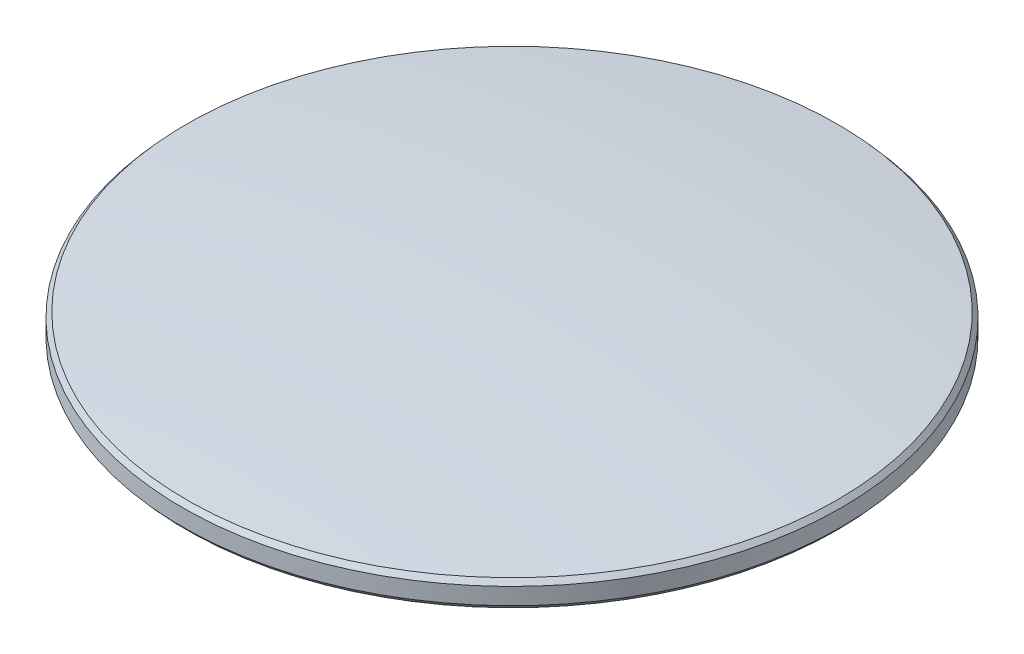
from build123d import *

# Parameters (mm, degrees)
CHANFREIN1_SIZE              = 0.5
CHANFREIN1_OF_SYM_TRIE1_SIZE = 0.5


with BuildPart() as part:
    # Esquisse1 → Révolution1 (revolve)
    with BuildSketch(Plane.XY, mode=Mode.PRIVATE) as r_volution1_sk:
        with BuildLine():
            Line((0, 0), (0, 4))
            ThreePointArc((0, 4), (-19.789517427, 3.374375349), (-39.5, 1.5))
            Line((-39.5, 1.5), (-39.5, 0))
            Line((-39.5, 0), (0, 0))
        make_face()
    r_volution1 = revolve(r_volution1_sk.sketch.rotate(Axis((0, 0, 0), (0, 1, 0)), 180), axis=Axis((0, 0, 0), (0, 1, 0)))

    # Chanfrein1
    chanfrein1_edges = [part.edges().sort_by_distance(p)[0] for p in [
        (-39.5, 1.5, 0),
    ]]
    chamfer(chanfrein1_edges, length=CHANFREIN1_SIZE)

    # Symétrie1: Révolution1 across plane
    add(r_volution1.mirror(Plane(origin=(-39.5, 0, 0), x_dir=(0, 0, 1), z_dir=(0, 1, 0))))

    # Chanfrein1 of Symétrie1
    chanfrein1_of_sym_trie1_edges = [part.edges().sort_by_distance(p)[0] for p in [
        (-39.5, -1.5, 0),
    ]]
    chamfer(chanfrein1_of_sym_trie1_edges, length=CHANFREIN1_OF_SYM_TRIE1_SIZE)


solid = part.part
